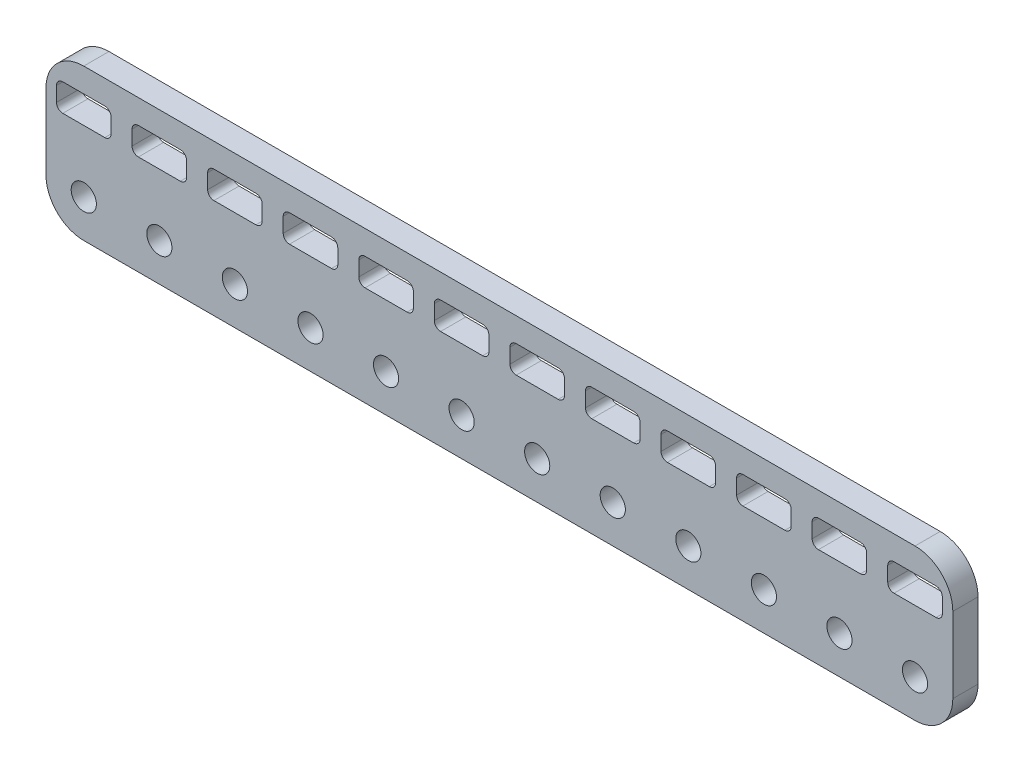
from build123d import *

# Parameters (mm, degrees)
MODEL_R                 = 1.5
SALIENTE_EXTRUIR1_DEPTH = 3


with BuildPart() as part:
    # Model → Saliente-Extruir1 (new body)
    with BuildSketch(Plane.XY):
        with BuildLine():
            Line((256.429131311, 228.742243614), (355.429131311, 228.742243614))
            ThreePointArc((355.429131311, 228.742243614), (358.611111826, 227.424224129), (359.929131311, 224.242243614))
            Line((359.929131311, 224.242243614), (359.929131311, 215.242243614))
            ThreePointArc((359.929131311, 215.242243614), (358.611111826, 212.060263099), (355.429131311, 210.742243614))
            Line((355.429131311, 210.742243614), (256.429131311, 210.742243614))
            ThreePointArc((256.429131311, 210.742243614), (253.247150795, 212.060263099), (251.929131311, 215.242243614))
            Line((251.929131311, 215.242243614), (251.929131311, 224.242243614))
            ThreePointArc((251.929131311, 224.242243614), (253.247150795, 227.424224129), (256.429131311, 228.742243614))
        make_face()
        with Locations((337.429131311, 215.242243614)):
            Circle(MODEL_R, mode=Mode.SUBTRACT)
        with Locations((319.429131311, 215.242243614)):
            Circle(MODEL_R, mode=Mode.SUBTRACT)
        with Locations((328.429131311, 215.242243614)):
            Circle(MODEL_R, mode=Mode.SUBTRACT)
        with Locations((310.429131311, 215.242243614)):
            Circle(MODEL_R, mode=Mode.SUBTRACT)
        with Locations((292.429131311, 215.242243614)):
            Circle(MODEL_R, mode=Mode.SUBTRACT)
        with Locations((301.429131311, 215.242243614)):
            Circle(MODEL_R, mode=Mode.SUBTRACT)
        with Locations((274.429131311, 215.242243614)):
            Circle(MODEL_R, mode=Mode.SUBTRACT)
        with Locations((283.429131311, 215.242243614)):
            Circle(MODEL_R, mode=Mode.SUBTRACT)
        with Locations((265.429131311, 215.242243614)):
            Circle(MODEL_R, mode=Mode.SUBTRACT)
        with Locations((256.429131311, 215.242243614)):
            Circle(MODEL_R, mode=Mode.SUBTRACT)
        with Locations((346.429131311, 215.242243614)):
            Circle(MODEL_R, mode=Mode.SUBTRACT)
        with Locations((355.429131311, 215.242243614)):
            Circle(MODEL_R, mode=Mode.SUBTRACT)
        with BuildLine():
            Line((267.929131311, 222.617243614), (262.929131311, 222.617243614))
            ThreePointArc((262.929131311, 222.617243614), (262.398801225, 222.836913528), (262.179131311, 223.367243614))
            Line((262.179131311, 223.367243614), (262.179131311, 225.117243614))
            ThreePointArc((262.179131311, 225.117243614), (262.398801225, 225.6475737), (262.929131311, 225.867243614))
            Line((262.929131311, 225.867243614), (267.929131311, 225.867243614))
            ThreePointArc((267.929131311, 225.867243614), (268.459461397, 225.6475737), (268.679131311, 225.117243614))
            Line((268.679131311, 225.117243614), (268.679131311, 223.367243614))
            ThreePointArc((268.679131311, 223.367243614), (268.459461397, 222.836913528), (267.929131311, 222.617243614))
        make_face(mode=Mode.SUBTRACT)
        with BuildLine():
            Line((285.929131311, 222.617243614), (280.929131311, 222.617243614))
            ThreePointArc((280.929131311, 222.617243614), (280.398801225, 222.836913528), (280.179131311, 223.367243614))
            Line((280.179131311, 223.367243614), (280.179131311, 225.117243614))
            ThreePointArc((280.179131311, 225.117243614), (280.398801225, 225.6475737), (280.929131311, 225.867243614))
            Line((280.929131311, 225.867243614), (285.929131311, 225.867243614))
            ThreePointArc((285.929131311, 225.867243614), (286.459461397, 225.6475737), (286.679131311, 225.117243614))
            Line((286.679131311, 225.117243614), (286.679131311, 223.367243614))
            ThreePointArc((286.679131311, 223.367243614), (286.459461397, 222.836913528), (285.929131311, 222.617243614))
        make_face(mode=Mode.SUBTRACT)
        with BuildLine():
            Line((258.929131311, 222.617243614), (253.929131311, 222.617243614))
            ThreePointArc((253.929131311, 222.617243614), (253.398801225, 222.836913528), (253.179131311, 223.367243614))
            Line((253.179131311, 223.367243614), (253.179131311, 225.117243614))
            ThreePointArc((253.179131311, 225.117243614), (253.398801225, 225.6475737), (253.929131311, 225.867243614))
            Line((253.929131311, 225.867243614), (258.929131311, 225.867243614))
            ThreePointArc((258.929131311, 225.867243614), (259.459461397, 225.6475737), (259.679131311, 225.117243614))
            Line((259.679131311, 225.117243614), (259.679131311, 223.367243614))
            ThreePointArc((259.679131311, 223.367243614), (259.459461397, 222.836913528), (258.929131311, 222.617243614))
        make_face(mode=Mode.SUBTRACT)
        with BuildLine():
            Line((276.929131311, 222.617243614), (271.929131311, 222.617243614))
            ThreePointArc((271.929131311, 222.617243614), (271.398801225, 222.836913528), (271.179131311, 223.367243614))
            Line((271.179131311, 223.367243614), (271.179131311, 225.117243614))
            ThreePointArc((271.179131311, 225.117243614), (271.398801225, 225.6475737), (271.929131311, 225.867243614))
            Line((271.929131311, 225.867243614), (276.929131311, 225.867243614))
            ThreePointArc((276.929131311, 225.867243614), (277.459461397, 225.6475737), (277.679131311, 225.117243614))
            Line((277.679131311, 225.117243614), (277.679131311, 223.367243614))
            ThreePointArc((277.679131311, 223.367243614), (277.459461397, 222.836913528), (276.929131311, 222.617243614))
        make_face(mode=Mode.SUBTRACT)
        with BuildLine():
            Line((294.929131311, 222.617243614), (289.929131311, 222.617243614))
            ThreePointArc((289.929131311, 222.617243614), (289.398801225, 222.836913528), (289.179131311, 223.367243614))
            Line((289.179131311, 223.367243614), (289.179131311, 225.117243614))
            ThreePointArc((289.179131311, 225.117243614), (289.398801225, 225.6475737), (289.929131311, 225.867243614))
            Line((289.929131311, 225.867243614), (294.929131311, 225.867243614))
            ThreePointArc((294.929131311, 225.867243614), (295.459461397, 225.6475737), (295.679131311, 225.117243614))
            Line((295.679131311, 225.117243614), (295.679131311, 223.367243614))
            ThreePointArc((295.679131311, 223.367243614), (295.459461397, 222.836913528), (294.929131311, 222.617243614))
        make_face(mode=Mode.SUBTRACT)
        with BuildLine():
            Line((303.929131311, 222.617243614), (298.929131311, 222.617243614))
            ThreePointArc((298.929131311, 222.617243614), (298.398801225, 222.836913528), (298.179131311, 223.367243614))
            Line((298.179131311, 223.367243614), (298.179131311, 225.117243614))
            ThreePointArc((298.179131311, 225.117243614), (298.398801225, 225.6475737), (298.929131311, 225.867243614))
            Line((298.929131311, 225.867243614), (303.929131311, 225.867243614))
            ThreePointArc((303.929131311, 225.867243614), (304.459461397, 225.6475737), (304.679131311, 225.117243614))
            Line((304.679131311, 225.117243614), (304.679131311, 223.367243614))
            ThreePointArc((304.679131311, 223.367243614), (304.459461397, 222.836913528), (303.929131311, 222.617243614))
        make_face(mode=Mode.SUBTRACT)
        with BuildLine():
            Line((321.929131311, 222.617243614), (316.929131311, 222.617243614))
            ThreePointArc((316.929131311, 222.617243614), (316.398801225, 222.836913528), (316.179131311, 223.367243614))
            Line((316.179131311, 223.367243614), (316.179131311, 225.117243614))
            ThreePointArc((316.179131311, 225.117243614), (316.398801225, 225.6475737), (316.929131311, 225.867243614))
            Line((316.929131311, 225.867243614), (321.929131311, 225.867243614))
            ThreePointArc((321.929131311, 225.867243614), (322.459461397, 225.6475737), (322.679131311, 225.117243614))
            Line((322.679131311, 225.117243614), (322.679131311, 223.367243614))
            ThreePointArc((322.679131311, 223.367243614), (322.459461397, 222.836913528), (321.929131311, 222.617243614))
        make_face(mode=Mode.SUBTRACT)
        with BuildLine():
            Line((312.929131311, 222.617243614), (307.929131311, 222.617243614))
            ThreePointArc((307.929131311, 222.617243614), (307.398801225, 222.836913528), (307.179131311, 223.367243614))
            Line((307.179131311, 223.367243614), (307.179131311, 225.117243614))
            ThreePointArc((307.179131311, 225.117243614), (307.398801225, 225.6475737), (307.929131311, 225.867243614))
            Line((307.929131311, 225.867243614), (312.929131311, 225.867243614))
            ThreePointArc((312.929131311, 225.867243614), (313.459461397, 225.6475737), (313.679131311, 225.117243614))
            Line((313.679131311, 225.117243614), (313.679131311, 223.367243614))
            ThreePointArc((313.679131311, 223.367243614), (313.459461397, 222.836913528), (312.929131311, 222.617243614))
        make_face(mode=Mode.SUBTRACT)
        with BuildLine():
            Line((357.929131311, 222.617243614), (352.929131311, 222.617243614))
            ThreePointArc((352.929131311, 222.617243614), (352.398801225, 222.836913528), (352.179131311, 223.367243614))
            Line((352.179131311, 223.367243614), (352.179131311, 225.117243614))
            ThreePointArc((352.179131311, 225.117243614), (352.398801225, 225.6475737), (352.929131311, 225.867243614))
            Line((352.929131311, 225.867243614), (357.929131311, 225.867243614))
            ThreePointArc((357.929131311, 225.867243614), (358.459461397, 225.6475737), (358.679131311, 225.117243614))
            Line((358.679131311, 225.117243614), (358.679131311, 223.367243614))
            ThreePointArc((358.679131311, 223.367243614), (358.459461397, 222.836913528), (357.929131311, 222.617243614))
        make_face(mode=Mode.SUBTRACT)
        with BuildLine():
            Line((348.929131311, 222.617243614), (343.929131311, 222.617243614))
            ThreePointArc((343.929131311, 222.617243614), (343.398801225, 222.836913528), (343.179131311, 223.367243614))
            Line((343.179131311, 223.367243614), (343.179131311, 225.117243614))
            ThreePointArc((343.179131311, 225.117243614), (343.398801225, 225.6475737), (343.929131311, 225.867243614))
            Line((343.929131311, 225.867243614), (348.929131311, 225.867243614))
            ThreePointArc((348.929131311, 225.867243614), (349.459461397, 225.6475737), (349.679131311, 225.117243614))
            Line((349.679131311, 225.117243614), (349.679131311, 223.367243614))
            ThreePointArc((349.679131311, 223.367243614), (349.459461397, 222.836913528), (348.929131311, 222.617243614))
        make_face(mode=Mode.SUBTRACT)
        with BuildLine():
            Line((339.929131311, 222.617243614), (334.929131311, 222.617243614))
            ThreePointArc((334.929131311, 222.617243614), (334.398801225, 222.836913528), (334.179131311, 223.367243614))
            Line((334.179131311, 223.367243614), (334.179131311, 225.117243614))
            ThreePointArc((334.179131311, 225.117243614), (334.398801225, 225.6475737), (334.929131311, 225.867243614))
            Line((334.929131311, 225.867243614), (339.929131311, 225.867243614))
            ThreePointArc((339.929131311, 225.867243614), (340.459461397, 225.6475737), (340.679131311, 225.117243614))
            Line((340.679131311, 225.117243614), (340.679131311, 223.367243614))
            ThreePointArc((340.679131311, 223.367243614), (340.459461397, 222.836913528), (339.929131311, 222.617243614))
        make_face(mode=Mode.SUBTRACT)
        with BuildLine():
            Line((330.929131311, 222.617243614), (325.929131311, 222.617243614))
            ThreePointArc((325.929131311, 222.617243614), (325.398801225, 222.836913528), (325.179131311, 223.367243614))
            Line((325.179131311, 223.367243614), (325.179131311, 225.117243614))
            ThreePointArc((325.179131311, 225.117243614), (325.398801225, 225.6475737), (325.929131311, 225.867243614))
            Line((325.929131311, 225.867243614), (330.929131311, 225.867243614))
            ThreePointArc((330.929131311, 225.867243614), (331.459461397, 225.6475737), (331.679131311, 225.117243614))
            Line((331.679131311, 225.117243614), (331.679131311, 223.367243614))
            ThreePointArc((331.679131311, 223.367243614), (331.459461397, 222.836913528), (330.929131311, 222.617243614))
        make_face(mode=Mode.SUBTRACT)
    extrude(amount=SALIENTE_EXTRUIR1_DEPTH)


solid = part.part
